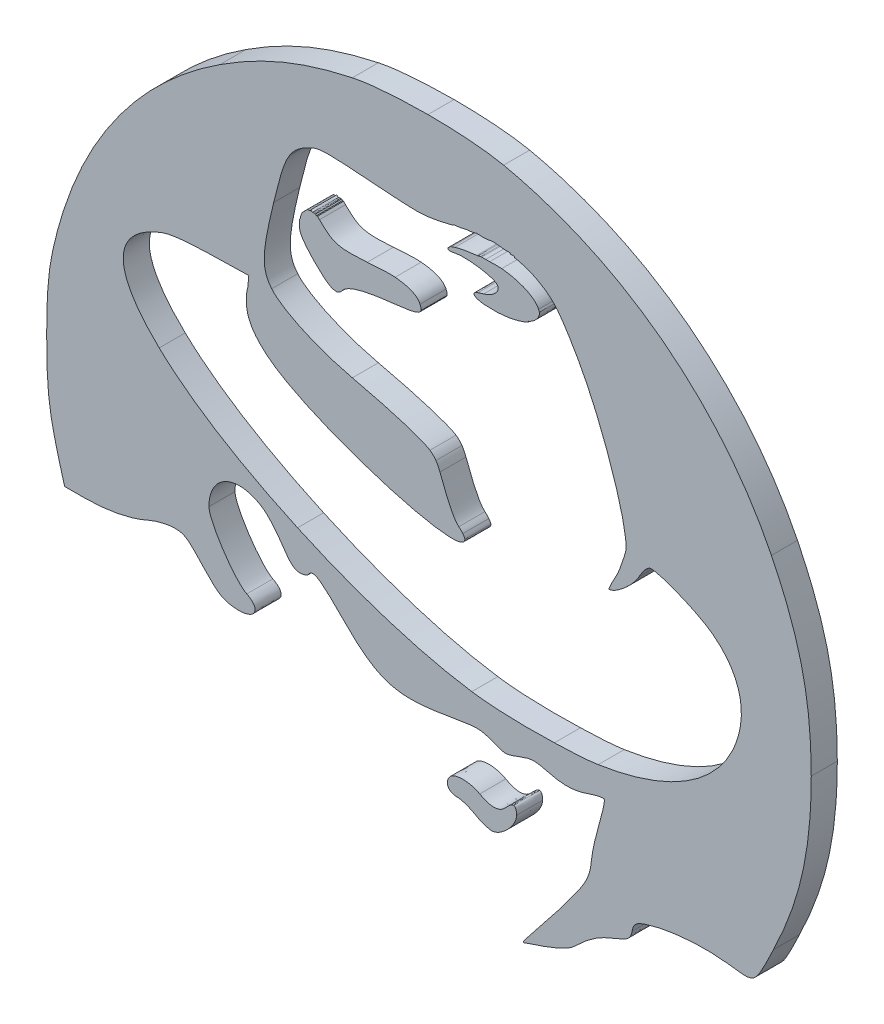
from build123d import *

# Parameters (mm, degrees)
BOSS_EXTRUDE1_DEPTH   = 1
BOSS_EXTRUDE1_2_DEPTH = 1
BOSS_EXTRUDE1_3_DEPTH = 1
BOSS_EXTRUDE1_4_DEPTH = 1


with BuildPart() as part:
    # Model → Boss-Extrude1 (new body)
    with BuildSketch(Plane.XY):
        with BuildLine():
            Line((1068.556312337, 411.905379642), (1068.7473926, 411.217491))
            Line((1068.7473926, 411.217491), (1069.511713271, 411.217491))
            add(Edge.make_bspline(
                [(1069.511713271, 411.217491), (1070.437458308, 411.217491), (1071.319484357, 411.406125243), (1071.995755166, 411.714299379)],
                knots=[0, 0, 0, 0, 1, 1, 1, 1], degree=3))
            add(Edge.make_bspline(
                [(1071.995755166, 411.714299379), (1072.258681742, 411.834144834), (1072.698013223, 411.942372837), (1072.9511561, 411.943595847)],
                knots=[0, 0, 0, 0, 1, 1, 1, 1], degree=3))
            add(Edge.make_bspline(
                [(1072.9511561, 411.943595847), (1073.365723724, 411.946041867), (1073.468754125, 411.855851547), (1074.059421473, 411.217491)],
                knots=[0, 0, 0, 0, 1, 1, 1, 1], degree=3))
            add(Edge.make_bspline(
                [(1074.059421473, 411.217491), (1074.610955168, 410.621932374), (1074.795003695, 410.508201588), (1075.205902289, 410.453170329)],
                knots=[0, 0, 0, 0, 1, 1, 1, 1], degree=3))
            add(Edge.make_bspline(
                [(1075.205902289, 410.453170329), (1075.999572914, 410.345553831), (1076.373173132, 410.813318199), (1075.740926873, 411.141058971)],
                knots=[0, 0, 0, 0, 1, 1, 1, 1], degree=3))
            add(Edge.make_bspline(
                [(1075.740926873, 411.141058971), (1075.262767682, 411.38808756), (1074.28871756, 412.846105599), (1074.28871756, 413.319373131)],
                knots=[0, 0, 0, 0, 1, 1, 1, 1], degree=3))
            add(Edge.make_bspline(
                [(1074.28871756, 413.319373131), (1074.28871756, 414.471357111), (1075.406154365, 414.975502788), (1076.390599691, 414.274773684)],
                knots=[0, 0, 0, 0, 1, 1, 1, 1], degree=3))
            add(Edge.make_bspline(
                [(1076.390599691, 414.274773684), (1076.570367683, 414.147590931), (1076.91003185, 413.755647087), (1077.116703776, 413.434020984)],
                knots=[0, 0, 0, 0, 1, 1, 1, 1], degree=3))
            add(Edge.make_bspline(
                [(1077.116703776, 413.434020984), (1077.391859309, 413.004778383), (1077.565818956, 412.860780576), (1077.766376594, 412.860780576)],
                knots=[0, 0, 0, 0, 1, 1, 1, 1], degree=3))
            add(Edge.make_bspline(
                [(1077.766376594, 412.860780576), (1077.915572003, 412.860780576), (1078.069965014, 412.910614233), (1078.110320915, 412.97542881)],
                knots=[0, 0, 0, 0, 1, 1, 1, 1], degree=3))
            add(Edge.make_bspline(
                [(1078.110320915, 412.97542881), (1078.271745662, 413.238355005), (1078.560964667, 413.041160073), (1079.40966617, 412.172891934)],
                knots=[0, 0, 0, 0, 1, 1, 1, 1], degree=3))
            add(Edge.make_bspline(
                [(1079.40966617, 412.172891934), (1080.778105775, 410.771433345), (1081.447955591, 410.589219333), (1083.498783341, 410.949978708)],
                knots=[0, 0, 0, 0, 1, 1, 1, 1], degree=3))
            add(Edge.make_bspline(
                [(1083.498783341, 410.949978708), (1084.595734538, 411.144422058), (1084.720473176, 411.13463874), (1085.180287979, 410.949978708)],
                knots=[0, 0, 0, 0, 1, 1, 1, 1], degree=3))
            add(Edge.make_bspline(
                [(1085.180287979, 410.949978708), (1085.640102401, 410.766541686), (1085.681070569, 410.761650027), (1086.173903213, 410.949978708)],
                knots=[0, 0, 0, 0, 1, 1, 1, 1], degree=3))
            add(Edge.make_bspline(
                [(1086.173903213, 410.949978708), (1086.616598924, 411.118740753), (1086.771603821, 411.142587543), (1087.205738081, 411.026410737)],
                knots=[0, 0, 0, 0, 1, 1, 1, 1], degree=3))
            add(Edge.make_bspline(
                [(1087.205738081, 411.026410737), (1087.888123559, 410.842973715), (1088.285570186, 410.853062976), (1088.887242338, 411.064626942)],
                knots=[0, 0, 0, 0, 1, 1, 1, 1], degree=3))
            add(Edge.make_bspline(
                [(1088.887242338, 411.064626942), (1089.161176766, 411.160014102), (1089.427464143, 411.213516408), (1089.460482746, 411.179275176)],
                knots=[0, 0, 0, 0, 1, 1, 1, 1], degree=3))
            add(Edge.make_bspline(
                [(1089.460482746, 411.179275176), (1089.493501349, 411.146256192), (1089.407593088, 410.72679729), (1089.269404388, 410.262090066)],
                knots=[0, 0, 0, 0, 1, 1, 1, 1], degree=3))
            add(Edge.make_bspline(
                [(1089.269404388, 410.262090066), (1089.131213021, 409.797383223), (1088.991801311, 409.161162753), (1088.963674748, 408.848096958)],
                knots=[0, 0, 0, 0, 1, 1, 1, 1], degree=3))
            add(Edge.make_bspline(
                [(1088.963674748, 408.848096958), (1088.926987496, 408.417631347), (1088.807752784, 408.129940914), (1088.428650926, 407.586967527)],
                knots=[0, 0, 0, 0, 1, 1, 1, 1], degree=3))
            add(Edge.make_bspline(
                [(1088.428650926, 407.586967527), (1087.368383933, 406.068109503), (1086.102362843, 404.726879394), (1086.403200443, 404.873628783)],
                knots=[0, 0, 0, 0, 1, 1, 1, 1], degree=3))
            add(Edge.make_bspline(
                [(1086.403200443, 404.873628783), (1086.531608111, 404.937220731), (1087.895767181, 405.304705899), (1088.314002311, 405.714381864)],
                knots=[0, 0, 0, 0, 1, 1, 1, 1], degree=3))
            add(Edge.make_bspline(
                [(1088.314002311, 405.714381864), (1088.861867738, 406.250017953), (1089.262372271, 406.512332643), (1089.766212386, 406.707999003)],
                knots=[0, 0, 0, 0, 1, 1, 1, 1], degree=3))
            add(Edge.make_bspline(
                [(1089.766212386, 406.707999003), (1090.362992879, 406.939129224), (1090.480393076, 407.025956076), (1090.530533819, 407.319455235)],
                knots=[0, 0, 0, 0, 1, 1, 1, 1], degree=3))
            add(Edge.make_bspline(
                [(1090.530533819, 407.319455235), (1090.578225494, 407.595833778), (1090.691345156, 407.69397252), (1091.065557641, 407.816263995)],
                knots=[0, 0, 0, 0, 1, 1, 1, 1], degree=3))
            add(Edge.make_bspline(
                [(1091.065557641, 407.816263995), (1091.905699979, 408.091419147), (1093.200153194, 408.208513401), (1094.199272354, 408.083776287)],
                knots=[0, 0, 0, 0, 1, 1, 1, 1], degree=3))
            add(Edge.make_bspline(
                [(1094.199272354, 408.083776287), (1095.302338601, 407.944363815), (1095.200226029, 407.859677421), (1095.957209021, 409.421337366)],
                knots=[0, 0, 0, 0, 1, 1, 1, 1], degree=3))
            add(Edge.make_bspline(
                [(1095.957209021, 409.421337366), (1097.001579551, 411.573664278), (1097.409419096, 413.431880907), (1097.409419096, 415.91806326)],
                knots=[0, 0, 0, 0, 1, 1, 1, 1], degree=3))
            add(Edge.make_bspline(
                [(1097.409419096, 415.91806326), (1097.409419096, 418.462945521), (1096.982622896, 420.256959078), (1095.880776611, 422.491221564)],
                knots=[0, 0, 0, 0, 1, 1, 1, 1], degree=3))
            add(Edge.make_bspline(
                [(1095.880776611, 422.491221564), (1093.914333884, 426.477918315), (1090.160907431, 429.342286602), (1085.600663186, 430.325508537)],
                knots=[0, 0, 0, 0, 1, 1, 1, 1], degree=3))
            add(Edge.make_bspline(
                [(1085.600663186, 430.325508537), (1084.931119694, 430.469812287), (1083.806804696, 430.557862149), (1082.696246084, 430.554805005)],
                knots=[0, 0, 0, 0, 1, 1, 1, 1], degree=3))
            add(Edge.make_bspline(
                [(1082.696246084, 430.554805005), (1081.585687091, 430.55174748), (1080.480326462, 430.473481317), (1079.791826696, 430.325508537)],
                knots=[0, 0, 0, 0, 1, 1, 1, 1], degree=3))
            add(Edge.make_bspline(
                [(1079.791826696, 430.325508537), (1077.864515336, 429.910941294), (1076.352689048, 429.290006925), (1074.70909391, 428.223626787)],
                knots=[0, 0, 0, 0, 1, 1, 1, 1], degree=3))
            add(Edge.make_bspline(
                [(1074.70909391, 428.223626787), (1071.357089057, 426.048064209), (1069.157068184, 422.816516316), (1068.288800045, 418.822482267)],
                knots=[0, 0, 0, 0, 1, 1, 1, 1], degree=3))
            add(Edge.make_bspline(
                [(1068.288800045, 418.822482267), (1068.128598308, 418.08261951), (1068.059503577, 417.352540452), (1068.059503577, 415.91806326)],
                knots=[0, 0, 0, 0, 1, 1, 1, 1], degree=3))
            add(Edge.make_bspline(
                [(1068.059503577, 415.91806326), (1068.059503577, 414.04211451), (1068.141744332, 413.431575345), (1068.556312337, 411.905379642)],
                knots=[0, 0, 0, 0, 1, 1, 1, 1], degree=3))
        make_face()
        with BuildLine():
            Line((1074.250501355, 421.726900893), (1075.817358902, 421.765116717))
            Line((1075.817358902, 421.765116717), (1075.779142697, 421.344740367))
            Line((1075.779142697, 421.344740367), (1075.740926873, 421.191876309))
            add(Edge.make_bspline(
                [(1075.740926873, 421.191876309), (1075.70913128, 420.920389425), (1075.719221303, 420.677335428), (1075.779142697, 420.465771462)],
                knots=[0, 0, 0, 0, 1, 1, 1, 1], degree=3))
            add(Edge.make_bspline(
                [(1075.779142697, 420.465771462), (1075.876975877, 420.123355713), (1076.09067992, 419.82679941), (1076.505247544, 419.472154704)],
                knots=[0, 0, 0, 0, 1, 1, 1, 1], degree=3))
            add(Edge.make_bspline(
                [(1076.505247544, 419.472154704), (1078.058347181, 418.14284799), (1084.110239954, 416.294720241), (1084.110239954, 417.140976486)],
                knots=[0, 0, 0, 0, 1, 1, 1, 1], degree=3))
            add(Edge.make_bspline(
                [(1084.110239954, 417.140976486), (1084.110239954, 417.185001417), (1084.082722229, 417.222911679), (1084.033807544, 417.293840544)],
                knots=[0, 0, 0, 0, 1, 1, 1, 1], degree=3))
            add(Edge.make_bspline(
                [(1084.033807544, 417.293840544), (1083.997119911, 417.345202773), (1083.932306096, 417.400234032), (1083.880942724, 417.446704602)],
                knots=[0, 0, 0, 0, 1, 1, 1, 1], degree=3))
            add(Edge.make_bspline(
                [(1083.880942724, 417.446704602), (1083.676717199, 417.630141624), (1083.488693699, 418.004964471), (1083.154837496, 418.898914296)],
                knots=[0, 0, 0, 0, 1, 1, 1, 1], degree=3))
            add(Edge.make_bspline(
                [(1083.154837496, 418.898914296), (1083.118150244, 418.997970105), (1083.072901541, 419.108032242), (1083.001972676, 419.204642412)],
                knots=[0, 0, 0, 0, 1, 1, 1, 1], degree=3))
            add(Edge.make_bspline(
                [(1083.001972676, 419.204642412), (1082.927374781, 419.30736687), (1082.847276389, 419.385021909), (1082.772678494, 419.433938499)],
                knots=[0, 0, 0, 0, 1, 1, 1, 1], degree=3))
            add(Edge.make_bspline(
                [(1082.772678494, 419.433938499), (1082.471840894, 419.632050498), (1081.386505244, 419.984249565), (1079.791826696, 420.351123228)],
                knots=[0, 0, 0, 0, 1, 1, 1, 1], degree=3))
            add(Edge.make_bspline(
                [(1079.791826696, 420.351123228), (1078.460074343, 420.656851725), (1077.110895431, 421.27105992), (1076.696327807, 421.765116717)],
                knots=[0, 0, 0, 0, 1, 1, 1, 1], degree=3))
            add(Edge.make_bspline(
                [(1076.696327807, 421.765116717), (1076.290320491, 422.248167186), (1076.323950599, 422.814376239), (1076.772759836, 424.669535343)],
                knots=[0, 0, 0, 0, 1, 1, 1, 1], degree=3))
            add(Edge.make_bspline(
                [(1076.772759836, 424.669535343), (1077.011228117, 425.657649318), (1077.154308857, 426.186253671), (1077.384216068, 426.542121006)],
                knots=[0, 0, 0, 0, 1, 1, 1, 1], degree=3))
            add(Edge.make_bspline(
                [(1077.384216068, 426.542121006), (1077.554201123, 426.806270592), (1077.750173045, 426.971058045), (1078.033888886, 427.115361795)],
                knots=[0, 0, 0, 0, 1, 1, 1, 1], degree=3))
            add(Edge.make_bspline(
                [(1078.033888886, 427.115361795), (1078.558518647, 427.383179649), (1078.446621995, 427.383485592), (1081.626195011, 427.153577619)],
                knots=[0, 0, 0, 0, 1, 1, 1, 1], degree=3))
            add(Edge.make_bspline(
                [(1081.626195011, 427.153577619), (1082.405192564, 427.097323731), (1082.791632101, 427.134318069), (1083.613429289, 427.344657882)],
                knots=[0, 0, 0, 0, 1, 1, 1, 1], degree=3))
            add(Edge.make_bspline(
                [(1083.613429289, 427.344657882), (1083.646447511, 427.351995942), (1083.658066106, 427.374313398), (1083.689861699, 427.382874087)],
                knots=[0, 0, 0, 0, 1, 1, 1, 1], degree=3))
            add(Edge.make_bspline(
                [(1083.689861699, 427.382874087), (1083.775466684, 427.404885219), (1083.872993159, 427.402745142), (1083.957375134, 427.421089911)],
                knots=[0, 0, 0, 0, 1, 1, 1, 1], degree=3))
            add(Edge.make_bspline(
                [(1083.957375134, 427.421089911), (1084.001400446, 427.429650981), (1084.067437271, 427.451968437), (1084.110239573, 427.459306116)],
                knots=[0, 0, 0, 0, 1, 1, 1, 1], degree=3))
            add(Edge.make_bspline(
                [(1084.110239573, 427.459306116), (1084.217856071, 427.480094238), (1084.313242088, 427.482846201), (1084.415966546, 427.49752194)],
                knots=[0, 0, 0, 0, 1, 1, 1, 1], degree=3))
            add(Edge.make_bspline(
                [(1084.415966546, 427.49752194), (1084.452653798, 427.50241398), (1084.495150538, 427.530846486), (1084.530615161, 427.535738145)],
                knots=[0, 0, 0, 0, 1, 1, 1, 1], degree=3))
            add(Edge.make_bspline(
                [(1084.530615161, 427.535738145), (1084.635785258, 427.549191255), (1084.734840686, 427.527177075), (1084.836344801, 427.535738145)],
                knots=[0, 0, 0, 0, 1, 1, 1, 1], degree=3))
            add(Edge.make_bspline(
                [(1084.836344801, 427.535738145), (1084.866917003, 427.53696687), (1084.883424971, 427.53450942), (1084.912774163, 427.535738145)],
                knots=[0, 0, 0, 0, 1, 1, 1, 1], degree=3))
            add(Edge.make_bspline(
                [(1084.912774163, 427.535738145), (1085.008163228, 427.541853195), (1085.088570611, 427.573953969), (1085.180287598, 427.573953969)],
                knots=[0, 0, 0, 0, 1, 1, 1, 1], degree=3))
            add(Edge.make_bspline(
                [(1085.180287598, 427.573953969), (1085.193746804, 427.573953969), (1085.243267279, 427.573953969), (1085.256720008, 427.573953969)],
                knots=[0, 0, 0, 0, 1, 1, 1, 1], degree=3))
            add(Edge.make_bspline(
                [(1085.256720008, 427.573953969), (1085.387570648, 427.572725244), (1085.514143801, 427.549190874), (1085.638879391, 427.535738145)],
                knots=[0, 0, 0, 0, 1, 1, 1, 1], degree=3))
            add(Edge.make_bspline(
                [(1085.638879391, 427.535738145), (1085.695134803, 427.528400085), (1085.774928014, 427.543076205), (1085.829960416, 427.535738145)],
                knots=[0, 0, 0, 0, 1, 1, 1, 1], degree=3))
            add(Edge.make_bspline(
                [(1085.829960416, 427.535738145), (1085.840961791, 427.533280695), (1085.855935091, 427.499967579), (1085.868176621, 427.49752194)],
                knots=[0, 0, 0, 0, 1, 1, 1, 1], degree=3))
            add(Edge.make_bspline(
                [(1085.868176621, 427.49752194), (1085.923206356, 427.48896087), (1085.967232049, 427.50852903), (1086.021041441, 427.49752194)],
                knots=[0, 0, 0, 0, 1, 1, 1, 1], degree=3))
            add(Edge.make_bspline(
                [(1086.021041441, 427.49752194), (1086.029613941, 427.49506449), (1086.012468941, 427.461751755), (1086.021041441, 427.459306116)],
                knots=[0, 0, 0, 0, 1, 1, 1, 1], degree=3))
            add(Edge.make_bspline(
                [(1086.021041441, 427.459306116), (1086.078517196, 427.447076016), (1086.155867054, 427.435766031), (1086.212119418, 427.421089911)],
                knots=[0, 0, 0, 0, 1, 1, 1, 1], degree=3))
            add(Edge.make_bspline(
                [(1086.212119418, 427.421089911), (1086.453035624, 427.353829695), (1086.682329806, 427.272200445), (1086.900008441, 427.153577619)],
                knots=[0, 0, 0, 0, 1, 1, 1, 1], degree=3))
            add(Edge.make_bspline(
                [(1086.900008441, 427.153577619), (1087.221634544, 426.979924296), (1087.440536189, 426.81238488), (1087.664329874, 426.542121006)],
                knots=[0, 0, 0, 0, 1, 1, 1, 1], degree=3))
            add(Edge.make_bspline(
                [(1087.664329874, 426.542121006), (1087.793960171, 426.385588299), (1087.917167189, 426.18992232), (1088.084705081, 425.930664393)],
                knots=[0, 0, 0, 0, 1, 1, 1, 1], degree=3))
            add(Edge.make_bspline(
                [(1088.084705081, 425.930664393), (1088.424676334, 425.402365983), (1088.818453931, 424.658223453), (1089.154755773, 423.866998848)],
                knots=[0, 0, 0, 0, 1, 1, 1, 1], degree=3))
            add(Edge.make_bspline(
                [(1089.154755773, 423.866998848), (1089.789446528, 422.375044758), (1090.301236589, 420.707602449), (1090.301236589, 419.968963083)],
                knots=[0, 0, 0, 0, 1, 1, 1, 1], degree=3))
            add(Edge.make_bspline(
                [(1090.301236589, 419.968963083), (1090.301236589, 419.819767674), (1090.233976373, 419.629298916), (1090.148371388, 419.395722675)],
                knots=[0, 0, 0, 0, 1, 1, 1, 1], degree=3))
            add(Edge.make_bspline(
                [(1090.148371388, 419.395722675), (1090.089672623, 419.235520938), (1090.041672338, 419.056670013), (1089.957293411, 418.898914296)],
                knots=[0, 0, 0, 0, 1, 1, 1, 1], degree=3))
            add(Edge.make_bspline(
                [(1089.957293411, 418.898914296), (1089.764071928, 418.536931911), (1089.607538459, 418.249241478), (1089.651563771, 418.249241478)],
                knots=[0, 0, 0, 0, 1, 1, 1, 1], degree=3))
            add(Edge.make_bspline(
                [(1089.651563771, 418.249241478), (1089.893699939, 418.249241478), (1090.569361529, 418.812393006), (1090.798044206, 419.242858236)],
                knots=[0, 0, 0, 0, 1, 1, 1, 1], degree=3))
            add(Edge.make_bspline(
                [(1090.798044206, 419.242858236), (1090.949686016, 419.527797087), (1091.142907499, 419.739666996), (1091.256638666, 419.739666996)],
                knots=[0, 0, 0, 0, 1, 1, 1, 1], degree=3))
            add(Edge.make_bspline(
                [(1091.256638666, 419.739666996), (1091.668758746, 419.739666996), (1093.075720499, 419.161840491), (1093.626031946, 418.746049857)],
                knots=[0, 0, 0, 0, 1, 1, 1, 1], degree=3))
            add(Edge.make_bspline(
                [(1093.626031946, 418.746049857), (1094.626374116, 417.985397835), (1094.943413741, 416.923297851), (1094.581431356, 415.765199202)],
                knots=[0, 0, 0, 0, 1, 1, 1, 1], degree=3))
            add(Edge.make_bspline(
                [(1094.581431356, 415.765199202), (1094.530070651, 415.598882796), (1094.471063276, 415.440821517), (1094.390353379, 415.268390823)],
                knots=[0, 0, 0, 0, 1, 1, 1, 1], degree=3))
            add(Edge.make_bspline(
                [(1094.390353379, 415.268390823), (1093.638262046, 413.687164242), (1091.831101703, 412.606108746), (1089.231188183, 412.211107758)],
                knots=[0, 0, 0, 0, 1, 1, 1, 1], degree=3))
            add(Edge.make_bspline(
                [(1089.231188183, 412.211107758), (1088.746913561, 412.137733254), (1088.161137491, 412.116026541), (1087.549680878, 412.096459905)],
                knots=[0, 0, 0, 0, 1, 1, 1, 1], degree=3))
            add(Edge.make_bspline(
                [(1087.549680878, 412.096459905), (1086.468626144, 412.060995282), (1085.296159604, 412.076587326), (1084.377750341, 412.211107758)],
                knots=[0, 0, 0, 0, 1, 1, 1, 1], degree=3))
            add(Edge.make_bspline(
                [(1084.377750341, 412.211107758), (1082.257219784, 412.521727914), (1079.874067451, 413.315092596), (1077.689944946, 414.312989889)],
                knots=[0, 0, 0, 0, 1, 1, 1, 1], degree=3))
            add(Edge.make_bspline(
                [(1077.689944946, 414.312989889), (1075.573081895, 415.277868198), (1073.63996219, 416.439329934), (1072.377915692, 417.637784865)],
                knots=[0, 0, 0, 0, 1, 1, 1, 1], degree=3))
            add(Edge.make_bspline(
                [(1072.377915692, 417.637784865), (1070.623035407, 419.305838298), (1070.53804307, 420.606406563), (1072.148619605, 421.382956191)],
                knots=[0, 0, 0, 0, 1, 1, 1, 1], degree=3))
            add(Edge.make_bspline(
                [(1072.148619605, 421.382956191), (1072.616995478, 421.609195134), (1072.946875946, 421.684098972), (1074.250501355, 421.726900893)],
                knots=[0, 0, 0, 0, 1, 1, 1, 1], degree=3))
        make_face(mode=Mode.SUBTRACT)
    extrude(amount=BOSS_EXTRUDE1_DEPTH)


with BuildPart() as body_2:
    # Model → Boss-Extrude1 2 (new body)
    with BuildSketch(Plane.XY):
        with BuildLine():
            Line((1078.110320915, 425.089912074), (1078.072105091, 425.089912074))
            add(Edge.make_bspline(
                [(1078.072105091, 425.089912074), (1078.057428971, 425.082574014), (1078.049788016, 425.060256177), (1078.033888886, 425.051695869)],
                knots=[0, 0, 0, 0, 1, 1, 1, 1], degree=3))
            add(Edge.make_bspline(
                [(1078.033888886, 425.051695869), (1078.013100764, 425.037019749), (1077.977023493, 424.994830476), (1077.957456857, 424.975263459)],
                knots=[0, 0, 0, 0, 1, 1, 1, 1], degree=3))
            add(Edge.make_bspline(
                [(1077.957456857, 424.975263459), (1077.942780737, 424.959364329), (1077.930247742, 424.954169394), (1077.919240652, 424.937047635)],
                knots=[0, 0, 0, 0, 1, 1, 1, 1], degree=3))
            add(Edge.make_bspline(
                [(1077.919240652, 424.937047635), (1077.911902973, 424.928486565), (1077.887139497, 424.907392119), (1077.881024828, 424.89883143)],
                knots=[0, 0, 0, 0, 1, 1, 1, 1], degree=3))
            add(Edge.make_bspline(
                [(1077.881024828, 424.89883143), (1077.866348708, 424.876820298), (1077.855038723, 424.848080706), (1077.842808623, 424.822399782)],
                knots=[0, 0, 0, 0, 1, 1, 1, 1], degree=3))
            add(Edge.make_bspline(
                [(1077.842808623, 424.822399782), (1077.828132503, 424.789380798), (1077.814376498, 424.7444388), (1077.804592799, 424.707751167)],
                knots=[0, 0, 0, 0, 1, 1, 1, 1], degree=3))
            add(Edge.make_bspline(
                [(1077.804592799, 424.707751167), (1077.802135349, 424.701636117), (1077.805821524, 424.675650012), (1077.804592799, 424.669535343)],
                knots=[0, 0, 0, 0, 1, 1, 1, 1], degree=3))
            add(Edge.make_bspline(
                [(1077.804592799, 424.669535343), (1077.794808719, 424.634071101), (1077.772491263, 424.629790566), (1077.766376594, 424.593103314)],
                knots=[0, 0, 0, 0, 1, 1, 1, 1], degree=3))
            add(Edge.make_bspline(
                [(1077.766376594, 424.593103314), (1077.766376594, 424.585765254), (1077.767605319, 424.562224788), (1077.766376594, 424.55488749)],
                knots=[0, 0, 0, 0, 1, 1, 1, 1], degree=3))
            add(Edge.make_bspline(
                [(1077.766376594, 424.55488749), (1077.762707564, 424.510862559), (1077.766376594, 424.449716631), (1077.766376594, 424.402023051)],
                knots=[0, 0, 0, 0, 1, 1, 1, 1], degree=3))
            add(Edge.make_bspline(
                [(1077.766376594, 424.402023051), (1077.766376594, 424.318864848), (1077.766690919, 424.261999455), (1077.804592799, 424.172726964)],
                knots=[0, 0, 0, 0, 1, 1, 1, 1], degree=3))
            add(Edge.make_bspline(
                [(1077.804592799, 424.172726964), (1077.881635952, 423.994181601), (1078.060793201, 423.770999802), (1078.339617002, 423.484838322)],
                knots=[0, 0, 0, 0, 1, 1, 1, 1], degree=3))
            add(Edge.make_bspline(
                [(1078.339617002, 423.484838322), (1078.740732659, 423.077607996), (1078.988372753, 422.899368576), (1079.180369702, 422.911597533)],
                knots=[0, 0, 0, 0, 1, 1, 1, 1], degree=3))
            add(Edge.make_bspline(
                [(1079.180369702, 422.911597533), (1079.274534233, 422.917712583), (1079.332622636, 422.971520451), (1079.40966617, 423.064461972)],
                knots=[0, 0, 0, 0, 1, 1, 1, 1], degree=3))
            add(Edge.make_bspline(
                [(1079.40966617, 423.064461972), (1079.612669828, 423.309044541), (1080.169400744, 423.477195081), (1081.282251833, 423.599486556)],
                knots=[0, 0, 0, 0, 1, 1, 1, 1], degree=3))
            add(Edge.make_bspline(
                [(1081.282251833, 423.599486556), (1082.053911326, 423.683867388), (1082.371256513, 423.745012935), (1082.428732268, 423.905214672)],
                knots=[0, 0, 0, 0, 1, 1, 1, 1], degree=3))
            add(Edge.make_bspline(
                [(1082.428732268, 423.905214672), (1082.447077418, 423.959022921), (1082.419874018, 424.020474411), (1082.390516063, 424.096294935)],
                knots=[0, 0, 0, 0, 1, 1, 1, 1], degree=3))
            add(Edge.make_bspline(
                [(1082.390516063, 424.096294935), (1082.306137136, 424.315196199), (1081.982982461, 424.471423344), (1081.435116653, 424.516671285)],
                knots=[0, 0, 0, 0, 1, 1, 1, 1], degree=3))
            add(Edge.make_bspline(
                [(1081.435116653, 424.516671285), (1081.139171093, 424.541128437), (1080.786972026, 424.506581262), (1080.365067104, 424.47845508)],
                knots=[0, 0, 0, 0, 1, 1, 1, 1], degree=3))
            add(Edge.make_bspline(
                [(1080.365067104, 424.47845508), (1079.211860114, 424.402634556), (1079.046766718, 424.471422963), (1078.530697265, 424.97526384)],
                knots=[0, 0, 0, 0, 1, 1, 1, 1], degree=3))
            add(Edge.make_bspline(
                [(1078.530697265, 424.97526384), (1078.503793712, 425.002167012), (1078.48116917, 425.033352243), (1078.454265236, 425.051695869)],
                knots=[0, 0, 0, 0, 1, 1, 1, 1], degree=3))
            add(Edge.make_bspline(
                [(1078.454265236, 425.051695869), (1078.451807786, 425.052924594), (1078.418495051, 425.051695869), (1078.416049031, 425.051695869)],
                knots=[0, 0, 0, 0, 1, 1, 1, 1], degree=3))
            add(Edge.make_bspline(
                [(1078.416049031, 425.051695869), (1078.394037899, 425.067594999), (1078.401067349, 425.080127994), (1078.377833207, 425.089912074)],
                knots=[0, 0, 0, 0, 1, 1, 1, 1], degree=3))
            add(Edge.make_bspline(
                [(1078.377833207, 425.089912074), (1078.371718157, 425.092369524), (1078.345731671, 425.087454624), (1078.339617002, 425.089912074)],
                knots=[0, 0, 0, 0, 1, 1, 1, 1], degree=3))
            add(Edge.make_bspline(
                [(1078.339617002, 425.089912074), (1078.31882888, 425.098473144), (1078.3221893, 425.085020034), (1078.301401178, 425.089912074)],
                knots=[0, 0, 0, 0, 1, 1, 1, 1], degree=3))
            add(Edge.make_bspline(
                [(1078.301401178, 425.089912074), (1078.294063118, 425.091140799), (1078.269299642, 425.088683349), (1078.263185354, 425.089912074)],
                knots=[0, 0, 0, 0, 1, 1, 1, 1], degree=3))
            add(Edge.make_bspline(
                [(1078.263185354, 425.089912074), (1078.238727821, 425.093581104), (1078.211211239, 425.130573537), (1078.186752944, 425.128127898)],
                knots=[0, 0, 0, 0, 1, 1, 1, 1], degree=3))
            add(Edge.make_bspline(
                [(1078.186752944, 425.128127898), (1078.184295494, 425.128127898), (1078.189210394, 425.089912074), (1078.186752944, 425.089912074)],
                knots=[0, 0, 0, 0, 1, 1, 1, 1], degree=3))
            add(Edge.make_bspline(
                [(1078.186752944, 425.089912074), (1078.163518802, 425.087454624), (1078.132333571, 425.097250134), (1078.110320915, 425.089912074)],
                knots=[0, 0, 0, 0, 1, 1, 1, 1], degree=3))
        make_face()
    extrude(amount=BOSS_EXTRUDE1_2_DEPTH)


with BuildPart() as body_3:
    # Model → Boss-Extrude1 3 (new body)
    with BuildSketch(Plane.XY):
        with BuildLine():
            add(Edge.make_bspline(
                [(1084.721696186, 426.847849503), (1084.674001463, 426.842957463), (1084.654742294, 426.815747967), (1084.607047571, 426.809633298)],
                knots=[0, 0, 0, 0, 1, 1, 1, 1], degree=3))
            add(Edge.make_bspline(
                [(1084.607047571, 426.809633298), (1084.600932521, 426.809633298), (1084.574946416, 426.810862023), (1084.568831366, 426.809633298)],
                knots=[0, 0, 0, 0, 1, 1, 1, 1], degree=3))
            add(Edge.make_bspline(
                [(1084.568831366, 426.809633298), (1084.244759243, 426.772946046), (1083.942087128, 426.726475476), (1083.728077523, 426.65676924)],
                knots=[0, 0, 0, 0, 1, 1, 1, 1], degree=3))
            add(Edge.make_bspline(
                [(1083.728077523, 426.65676924), (1083.693836291, 426.64576215), (1083.642781529, 426.629560125), (1083.613429289, 426.618553416)],
                knots=[0, 0, 0, 0, 1, 1, 1, 1], degree=3))
            add(Edge.make_bspline(
                [(1083.613429289, 426.618553416), (1083.586540214, 426.607546326), (1083.557787668, 426.591344301), (1083.536999546, 426.580337211)],
                knots=[0, 0, 0, 0, 1, 1, 1, 1], degree=3))
            add(Edge.make_bspline(
                [(1083.536999546, 426.580337211), (1083.514996796, 426.569330121), (1083.513453746, 426.555574116), (1083.498783341, 426.542121006)],
                knots=[0, 0, 0, 0, 1, 1, 1, 1], degree=3))
            add(Edge.make_bspline(
                [(1083.498783341, 426.542121006), (1083.481666916, 426.529890906), (1083.469125158, 426.516134901), (1083.460567136, 426.503905182)],
                knots=[0, 0, 0, 0, 1, 1, 1, 1], degree=3))
            add(Edge.make_bspline(
                [(1083.460567136, 426.503905182), (1083.454452086, 426.493509597), (1083.461995886, 426.473638161), (1083.460567136, 426.465688977)],
                knots=[0, 0, 0, 0, 1, 1, 1, 1], degree=3))
            add(Edge.make_bspline(
                [(1083.460567136, 426.465688977), (1083.485027336, 426.436339023), (1083.560539631, 426.429001725), (1083.728077523, 426.465688977)],
                knots=[0, 0, 0, 0, 1, 1, 1, 1], degree=3))
            add(Edge.make_bspline(
                [(1083.728077523, 426.465688977), (1084.123078511, 426.552515829), (1085.034455276, 426.437256852), (1085.294936594, 426.274608714)],
                knots=[0, 0, 0, 0, 1, 1, 1, 1], degree=3))
            add(Edge.make_bspline(
                [(1085.294936594, 426.274608714), (1085.538295391, 426.121745037), (1085.288821163, 425.794003884), (1084.836344801, 425.663152482)],
                knots=[0, 0, 0, 0, 1, 1, 1, 1], degree=3))
            add(Edge.make_bspline(
                [(1084.836344801, 425.663152482), (1084.756854866, 425.641140969), (1084.660854296, 425.608732728), (1084.607047571, 425.586720453)],
                knots=[0, 0, 0, 0, 1, 1, 1, 1], degree=3))
            add(Edge.make_bspline(
                [(1084.607047571, 425.586720453), (1084.496985053, 425.539026492), (1084.445621681, 425.51242812), (1084.454182751, 425.472072219)],
                knots=[0, 0, 0, 0, 1, 1, 1, 1], degree=3))
            add(Edge.make_bspline(
                [(1084.454182751, 425.472072219), (1084.467641576, 425.413372311), (1084.609187648, 425.339997426), (1084.874557958, 425.319208161)],
                knots=[0, 0, 0, 0, 1, 1, 1, 1], degree=3))
            add(Edge.make_bspline(
                [(1084.874557958, 425.319208161), (1085.527593863, 425.265399912), (1086.162287666, 425.378824755), (1086.556065263, 425.586720453)],
                knots=[0, 0, 0, 0, 1, 1, 1, 1], degree=3))
            add(Edge.make_bspline(
                [(1086.556065263, 425.586720453), (1086.558637394, 425.587949178), (1086.554922263, 425.623713648), (1086.556065263, 425.624936277)],
                knots=[0, 0, 0, 0, 1, 1, 1, 1], degree=3))
            add(Edge.make_bspline(
                [(1086.556065263, 425.624936277), (1086.564638144, 425.629828317), (1086.586943408, 425.618821227), (1086.594281468, 425.624936277)],
                knots=[0, 0, 0, 0, 1, 1, 1, 1], degree=3))
            add(Edge.make_bspline(
                [(1086.594281468, 425.624936277), (1086.840086666, 425.763125358), (1086.989893961, 425.939530644), (1086.976440851, 426.121745037)],
                knots=[0, 0, 0, 0, 1, 1, 1, 1], degree=3))
            add(Edge.make_bspline(
                [(1086.976440851, 426.121745037), (1086.973869101, 426.15354063), (1086.950466176, 426.166381092), (1086.938224646, 426.198176685)],
                knots=[0, 0, 0, 0, 1, 1, 1, 1], degree=3))
            add(Edge.make_bspline(
                [(1086.938224646, 426.198176685), (1086.824493479, 426.503905182), (1086.255533606, 426.780589287), (1085.524230776, 426.847849503)],
                knots=[0, 0, 0, 0, 1, 1, 1, 1], degree=3))
            add(Edge.make_bspline(
                [(1085.524230776, 426.847849503), (1085.392157126, 426.858856593), (1085.223396224, 426.853964553), (1085.065638983, 426.847849503)],
                knots=[0, 0, 0, 0, 1, 1, 1, 1], degree=3))
            add(Edge.make_bspline(
                [(1085.065638983, 426.847849503), (1085.015501288, 426.846620778), (1084.964137916, 426.850306953), (1084.912774544, 426.847849503)],
                knots=[0, 0, 0, 0, 1, 1, 1, 1], degree=3))
            add(Edge.make_bspline(
                [(1084.912774544, 426.847849503), (1084.866305498, 426.844180473), (1084.806381056, 426.850306953), (1084.759912391, 426.847849503)],
                knots=[0, 0, 0, 0, 1, 1, 1, 1], degree=3))
            add(Edge.make_bspline(
                [(1084.759912391, 426.847849503), (1084.752568616, 426.846620778), (1084.729031579, 426.849078228), (1084.721696186, 426.847849503)],
                knots=[0, 0, 0, 0, 1, 1, 1, 1], degree=3))
        make_face()
    extrude(amount=BOSS_EXTRUDE1_3_DEPTH)


with BuildPart() as body_4:
    # Model → Boss-Extrude1 4 (new body)
    with BuildSketch(Plane.XY):
        with BuildLine():
            add(Edge.make_bspline(
                [(1085.982825236, 409.230257103), (1085.916328544, 409.241263431), (1085.819564831, 409.158105228), (1085.677095596, 409.000961016)],
                knots=[0, 0, 0, 0, 1, 1, 1, 1], degree=3))
            add(Edge.make_bspline(
                [(1085.677095596, 409.000961016), (1085.430067769, 408.729474132), (1085.093154041, 408.72916857), (1084.683479981, 408.962744811)],
                knots=[0, 0, 0, 0, 1, 1, 1, 1], degree=3))
            add(Edge.make_bspline(
                [(1084.683479981, 408.962744811), (1084.300706426, 409.181646456), (1083.719210891, 409.180423446), (1083.536999546, 408.962744811)],
                knots=[0, 0, 0, 0, 1, 1, 1, 1], degree=3))
            add(Edge.make_bspline(
                [(1083.536999546, 408.962744811), (1083.330324953, 408.713270583), (1083.462095708, 408.427720227), (1083.804510314, 408.427720227)],
                knots=[0, 0, 0, 0, 1, 1, 1, 1], degree=3))
            add(Edge.make_bspline(
                [(1083.804510314, 408.427720227), (1083.964713194, 408.427720227), (1084.282058381, 408.326829903), (1084.492398956, 408.19842414)],
                knots=[0, 0, 0, 0, 1, 1, 1, 1], degree=3))
            add(Edge.make_bspline(
                [(1084.492398956, 408.19842414), (1084.702739531, 408.070017996), (1084.994098613, 407.969128053), (1085.142071774, 407.969128053)],
                knots=[0, 0, 0, 0, 1, 1, 1, 1], degree=3))
            add(Edge.make_bspline(
                [(1085.142071774, 407.969128053), (1085.508946199, 407.967898947), (1086.097473851, 408.58364181), (1086.097473851, 408.962744811)],
                knots=[0, 0, 0, 0, 1, 1, 1, 1], degree=3))
            add(Edge.make_bspline(
                [(1086.097473851, 408.962744811), (1086.097473851, 409.143124689), (1086.049319261, 409.219251156), (1085.982825236, 409.230257103)],
                knots=[0, 0, 0, 0, 1, 1, 1, 1], degree=3))
        make_face()
    extrude(amount=BOSS_EXTRUDE1_4_DEPTH)


solid = Compound([part.part, body_2.part, body_3.part, body_4.part])
